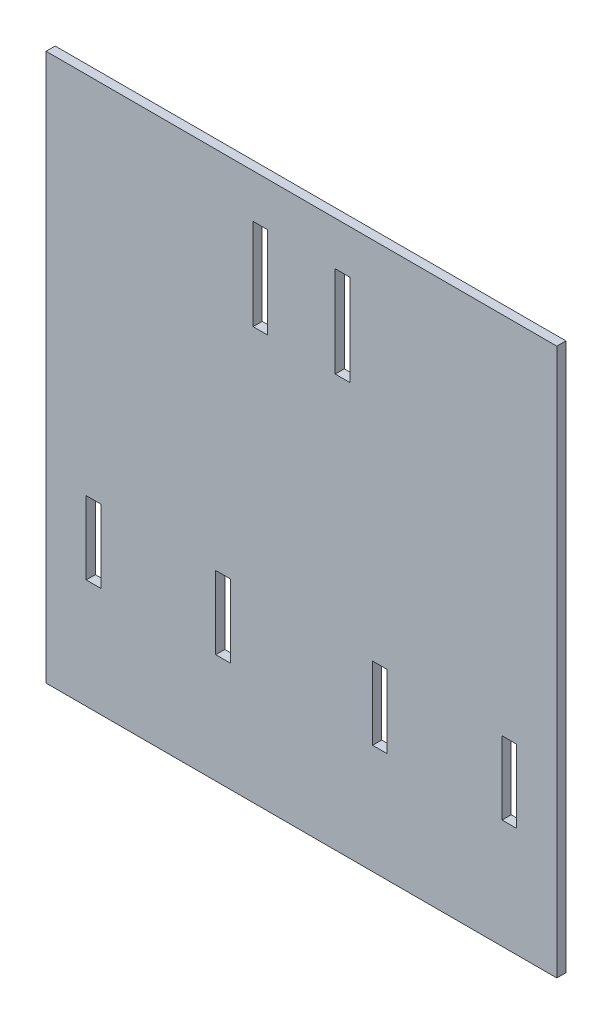
from build123d import *

# Parameters (mm, degrees)
SKETCH1_W           = 280
SKETCH1_H           = 300
BOSS_EXTRUDE1_DEPTH = 5
SKETCH2_W           = 8
SKETCH2_H           = 40
SKETCH2_H_2         = 50
CUT_EXTRUDE1_DEPTH  = 332.096662623


with BuildPart() as part:
    # Sketch1 → Boss-Extrude1 (new body)
    with BuildSketch(Plane.XY):
        with Locations((0, 150)):
            Rectangle(SKETCH1_W, SKETCH1_H)
    extrude(amount=BOSS_EXTRUDE1_DEPTH)

    # Sketch2 → Cut-Extrude1 (cut, through all)
    with BuildSketch(Plane(origin=(0, 0, 0), x_dir=(-1, 0, 0), z_dir=(0, 0, -1))):
        with Locations((-114, 80)):
            Rectangle(SKETCH2_W, SKETCH2_H)
        with Locations((-43, 80)):
            Rectangle(SKETCH2_W, SKETCH2_H)
        with Locations((43, 80)):
            Rectangle(SKETCH2_W, SKETCH2_H)
        with Locations((114, 80)):
            Rectangle(SKETCH2_W, SKETCH2_H)
        with Locations((-22.5, 251)):
            Rectangle(SKETCH2_W, SKETCH2_H_2)
        with Locations((22.5, 251)):
            Rectangle(SKETCH2_W, SKETCH2_H_2)
    extrude(amount=-CUT_EXTRUDE1_DEPTH, mode=Mode.SUBTRACT)


solid = part.part
